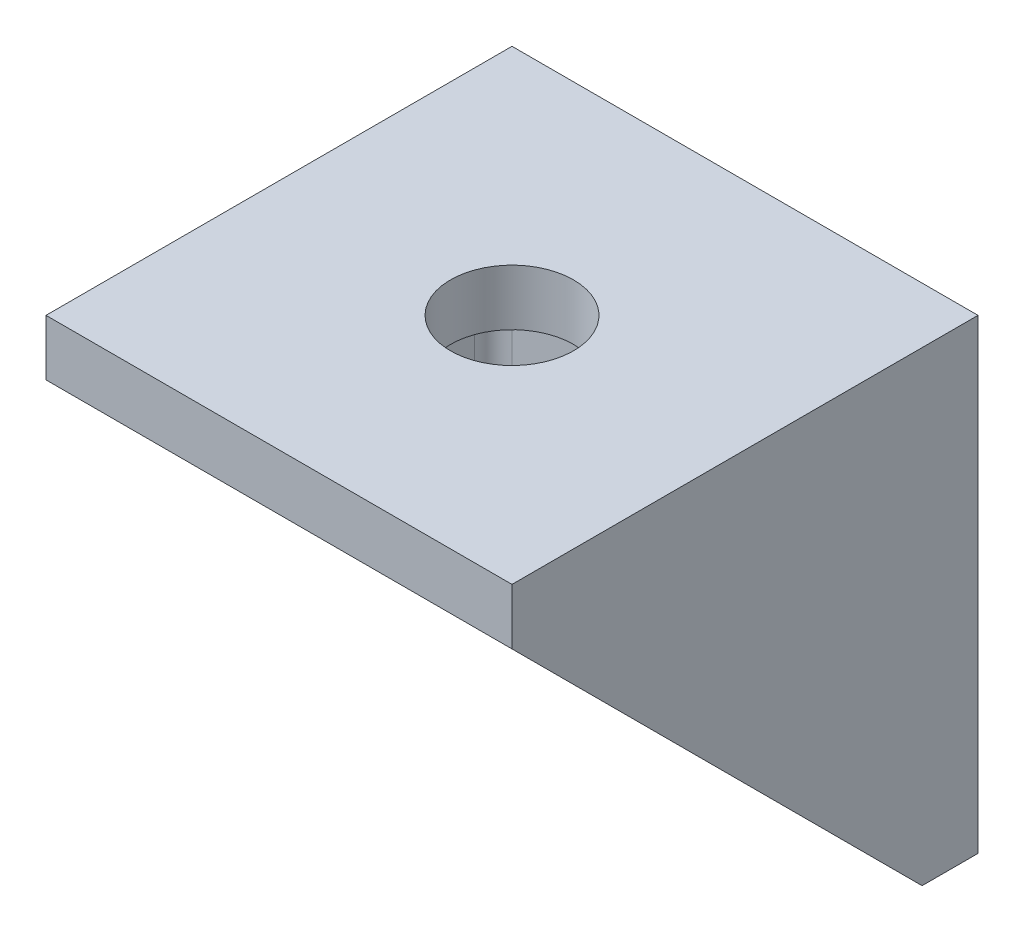
from build123d import *

# Parameters (mm, degrees)
SKETCH1_W            = 25
SKETCH1_H            = 25
BOSS_EXTRUDE1_DEPTH  = 3
SKETCH2_W            = 25
SKETCH2_H            = 3
BOSS_EXTRUDE2_DEPTH  = 22
BOSS_EXTRUDE3_DEPTH  = 2
BOSS_EXTRUDE4_DEPTH  = 2
M6_CLEARANCE_HOLE1_D = 6.6
M6_CLEARANCE_HOLE2_D = 6.6
FILLET1_R            = 1


with BuildPart() as part:
    # Sketch1 → Boss-Extrude1 (new body)
    with BuildSketch(Plane.XY):
        Rectangle(SKETCH1_W, SKETCH1_H)
    extrude(amount=BOSS_EXTRUDE1_DEPTH)

    # Sketch2 → Boss-Extrude2 (add)
    with BuildSketch(Plane.XY.offset(3)):
        with Locations((0, 11)):
            Rectangle(SKETCH2_W, SKETCH2_H)
    extrude(amount=BOSS_EXTRUDE2_DEPTH)

    # Sketch3 → Boss-Extrude3 (add)
    with BuildSketch(Plane(origin=(12.5, 0, 0), x_dir=(0, 0, -1), z_dir=(1, 0, 0))):
        Polygon((-25, 9.5), (-3, -12.5), (-3, 9.5), align=None)
    extrude(amount=-BOSS_EXTRUDE3_DEPTH)

    # Sketch4 → Boss-Extrude4 (add)
    with BuildSketch(Plane.ZY.offset(12.5)):
        Polygon((3, -12.5), (3, 9.5), (25, 9.5), align=None)
    extrude(amount=-BOSS_EXTRUDE4_DEPTH)

    # M6 Clearance Hole1 (through all)
    with Locations(Plane(origin=(0, 9.5, 0), x_dir=(-1, 0, 0), z_dir=(0, -1, 0))):
        with Locations((0, -12.5)):
            Hole(M6_CLEARANCE_HOLE1_D / 2)

    # M6 Clearance Hole2 (through all)
    with Locations(Plane.XY.offset(3)):
        with Locations((0, 0)):
            Hole(M6_CLEARANCE_HOLE2_D / 2)

    # Fillet1
    fillet1_edges = [part.edges().sort_by_distance(p)[0] for p in [
        (10.5, 9.5, 14),
        (10.5, -1.5, 3),
        (0, 9.5, 3),
        (-10.5, -1.5, 3),
        (-10.5, 9.5, 14),
    ]]
    fillet(fillet1_edges, radius=FILLET1_R)


solid = part.part
